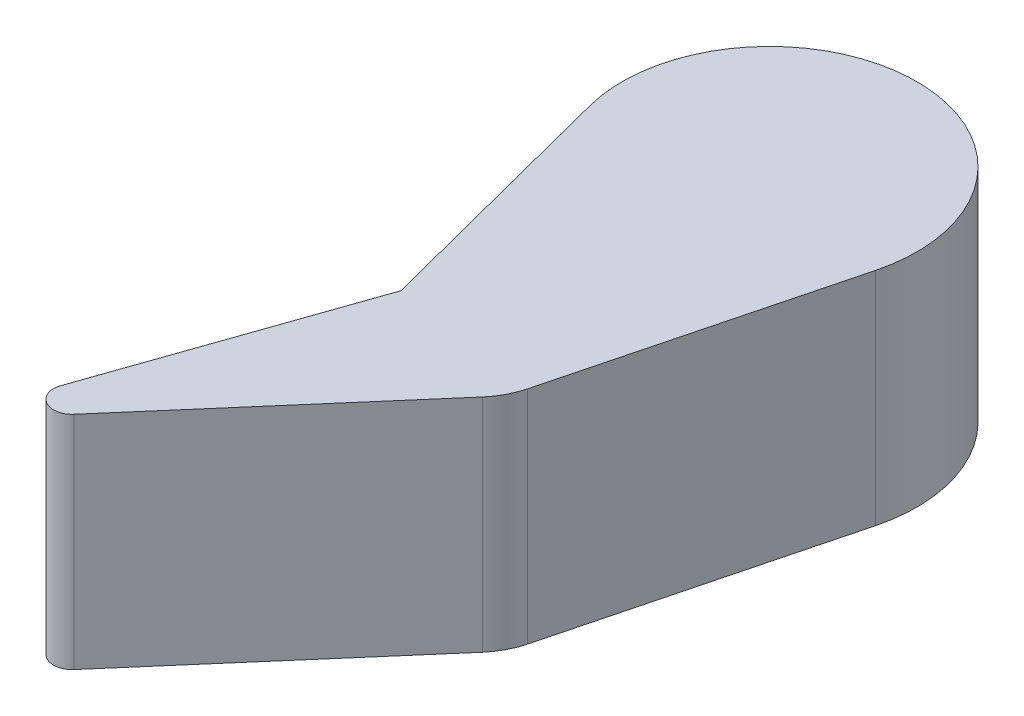
from build123d import *

# Parameters (mm, degrees)
BOSS_EXTRUDE1_DEPTH = 60


with BuildPart() as part:
    # Sketch1 → Boss-Extrude1 (new body)
    with BuildSketch(Plane(origin=(0, 0, 0), x_dir=(1, 0, 0), z_dir=(0, 1, 0))):
        with BuildLine():
            Line((-38.729833462, -10), (-20.877867157, -79.140368196))
            Line((-20.877867157, -79.140368196), (-44.722080497, -147.638269612))
            ThreePointArc((-44.722080497, -147.638269612), (-42.5, -153.612159322), (-36.215419503, -152.549592626))
            Line((-36.215419503, -152.549592626), (15.138321986, -93.070241293))
            ThreePointArc((15.138321986, -93.070241293), (17.71723932, -89.278977901), (19.364916731, -85))
            Line((19.364916731, -85), (38.729833462, -10))
            ThreePointArc((38.729833462, -10), (0, 40), (-38.729833462, -10))
        make_face()
    extrude(amount=BOSS_EXTRUDE1_DEPTH)


solid = part.part
